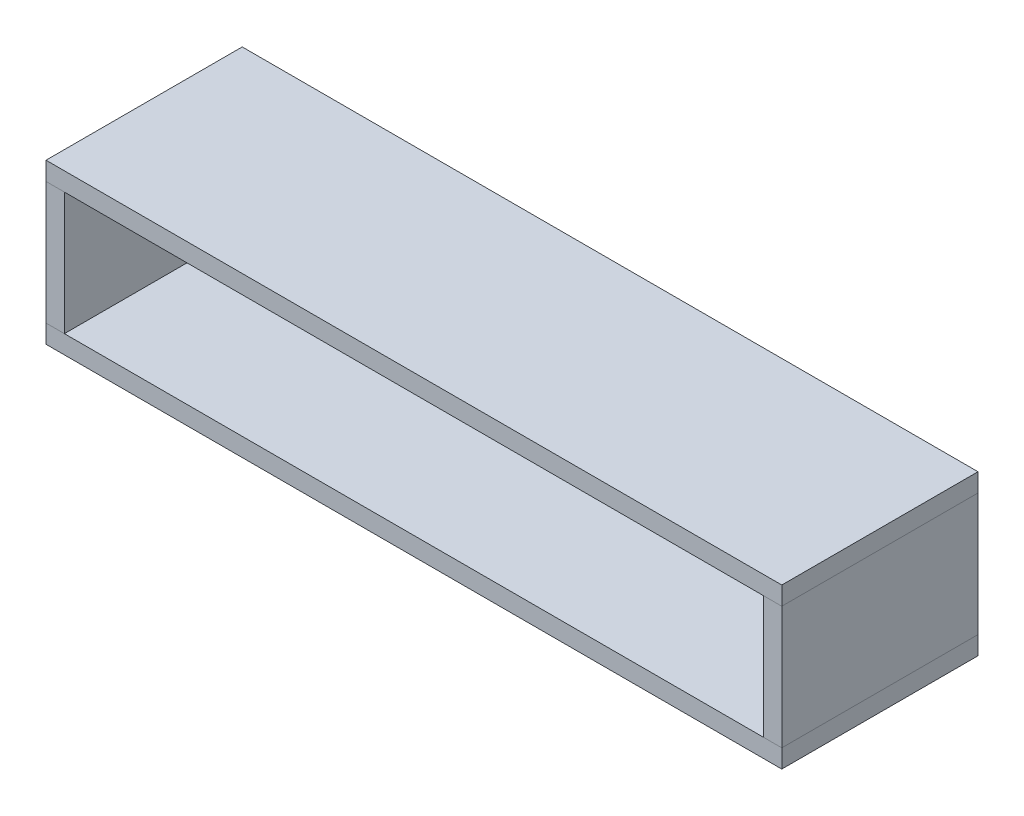
from build123d import *

# Parameters (mm, degrees)
SKETCH1_W             = 762
SKETCH1_H             = 203.2
BOSS_EXTRUDE1_DEPTH   = 19.05
BOSS_EXTRUDE2_DEPTH   = 127
BOSS_EXTRUDE2_2_DEPTH = 127
SKETCH2_3_W           = 723.9
SKETCH2_3_H           = 19.05
BOSS_EXTRUDE3_DEPTH   = 127
SKETCH3_W             = 762
SKETCH3_H             = 203.2
BOSS_EXTRUDE4_DEPTH   = 19.05


with BuildPart() as part:
    # Sketch1 → Boss-Extrude1 (new body)
    with BuildSketch(Plane(origin=(0, 0, 0), x_dir=(1, 0, 0), z_dir=(0, 1, 0))):
        Rectangle(SKETCH1_W, SKETCH1_H)
    extrude(amount=BOSS_EXTRUDE1_DEPTH)


with BuildPart() as body_2:
    # Sketch2 → Boss-Extrude2 (new body)
    with BuildSketch(Plane(origin=(0, 19.05, 0), x_dir=(1, 0, 0), z_dir=(0, 1, 0))):
        Polygon((-361.95, 101.6), (-381, 101.6), (-381, -101.6), (-361.95, -101.6), (-361.95, 82.55), align=None)
    extrude(amount=BOSS_EXTRUDE2_DEPTH)


with BuildPart() as body_3:
    # Sketch2 → Boss-Extrude2 2 (new body)
    with BuildSketch(Plane(origin=(0, 19.05, 0), x_dir=(1, 0, 0), z_dir=(0, 1, 0))):
        Polygon((381, 101.6), (361.95, 101.6), (361.95, 82.55), (361.95, -101.6), (381, -101.6), align=None)
    extrude(amount=BOSS_EXTRUDE2_2_DEPTH)


with BuildPart() as body_4:
    # Sketch2<3> → Boss-Extrude3 (new body)
    with BuildSketch(Plane(origin=(0, 19.05, 0), x_dir=(1, 0, 0), z_dir=(0, 1, 0))):
        with Locations((0, 92.075)):
            Rectangle(SKETCH2_3_W, SKETCH2_3_H)
    extrude(amount=BOSS_EXTRUDE3_DEPTH)


with BuildPart() as body_5:
    # Sketch3 → Boss-Extrude4 (new body)
    with BuildSketch(Plane(origin=(0, 146.05, 0), x_dir=(1, 0, 0), z_dir=(0, 1, 0))):
        Rectangle(SKETCH3_W, SKETCH3_H)
    extrude(amount=BOSS_EXTRUDE4_DEPTH)


solid = Compound([part.part, body_2.part, body_3.part, body_4.part, body_5.part])
